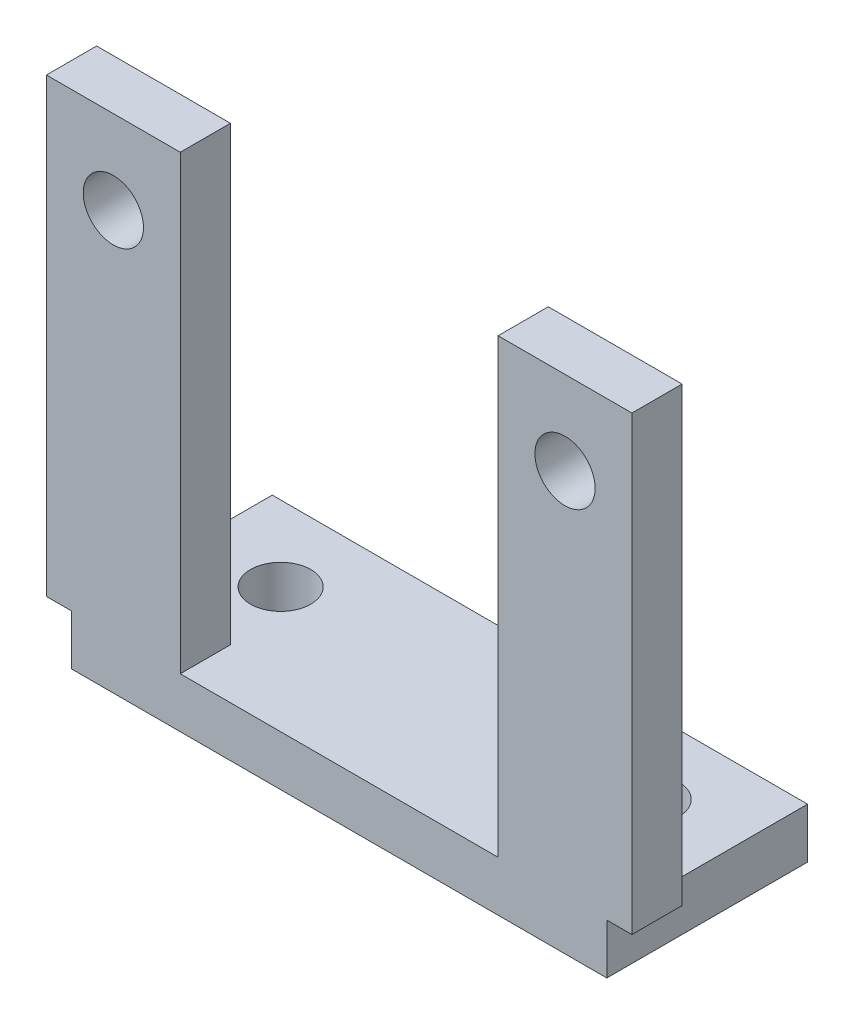
from build123d import *

# Parameters (mm, degrees)
SKETCH_1_W               = 32
SKETCH_1_H               = 12
F_32X12_3_3MM_DEPTH      = 3
SKETCH_2_W               = 8
SKETCH_2_H               = 27
EXTRUDE_3_DEPTH          = 3
SKETCH_3_R               = 1.8
CUT_EXTRUDE_3_6_27_DEPTH = 3
SKETCH_4_R               = 1.8
CUT_EXTRUDE_832_DEPTH    = 3


with BuildPart() as part:
    # 草图1 → 测距小底脚32x12_厚3_单向3mm (new body)
    with BuildSketch(Plane(origin=(0, 0, 0), x_dir=(1, 0, 0), z_dir=(0, 1, 0))):
        with Locations((0, 3)):
            Rectangle(SKETCH_1_W, SKETCH_1_H)
    extrude(amount=F_32X12_3_3MM_DEPTH)

    # 草图2 → 两根支撑臂厚3_去掉大框和加强筋 (add)
    with BuildSketch(Plane.XY):
        with Locations((-13.5, 16.5)):
            Rectangle(SKETCH_2_W, SKETCH_2_H)
        with Locations((13.5, 16.5)):
            Rectangle(SKETCH_2_W, SKETCH_2_H)
    extrude(amount=EXTRUDE_3_DEPTH)

    # 草图3 → 背板原孔3.6_只接下排两孔距27_贯穿 (cut)
    with BuildSketch(Plane.XY):
        with Locations((-13.5, 25)):
            Circle(SKETCH_3_R)
        with Locations((13.5, 25)):
            Circle(SKETCH_3_R)
    extrude(amount=CUT_EXTRUDE_3_6_27_DEPTH, mode=Mode.SUBTRACT)

    # 草图4 → Cut-Extrude 832 (cut)
    with BuildSketch(Plane(origin=(0, 0, 0), x_dir=(1, 0, 0), z_dir=(0, 1, 0))):
        with Locations(Location((-11, 4.5, 0), (0, 0, 270))):
            Circle(SKETCH_4_R)
        with Locations(Location((11, 4.5, 0), (0, 0, 270))):
            Circle(SKETCH_4_R)
    extrude(amount=CUT_EXTRUDE_832_DEPTH, mode=Mode.SUBTRACT)


solid = part.part
